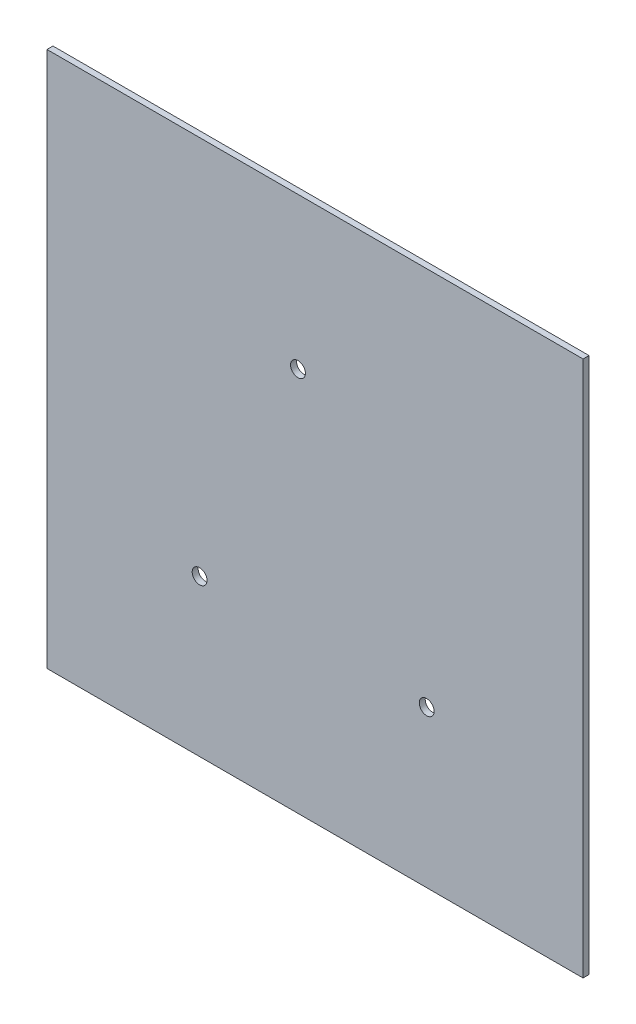
from build123d import *

# Parameters (mm, degrees)
SKETCH1_W           = 228.6
SKETCH1_H           = 228.6
SKETCH1_R           = 3.175
BOSS_EXTRUDE1_DEPTH = 2.54


with BuildPart() as part:
    # Sketch1 → Boss-Extrude1 (new body)
    with BuildSketch(Plane.XY):
        with Locations((-47.625, 47.625)):
            Rectangle(SKETCH1_W, SKETCH1_H)
        Circle(SKETCH1_R, mode=Mode.SUBTRACT)
        with Locations((-96.839734868, -0.073822651)):
            Circle(SKETCH1_R, mode=Mode.SUBTRACT)
        with Locations((-54.890998924, 97.390088929)):
            Circle(SKETCH1_R, mode=Mode.SUBTRACT)
    extrude(amount=BOSS_EXTRUDE1_DEPTH)


solid = part.part
